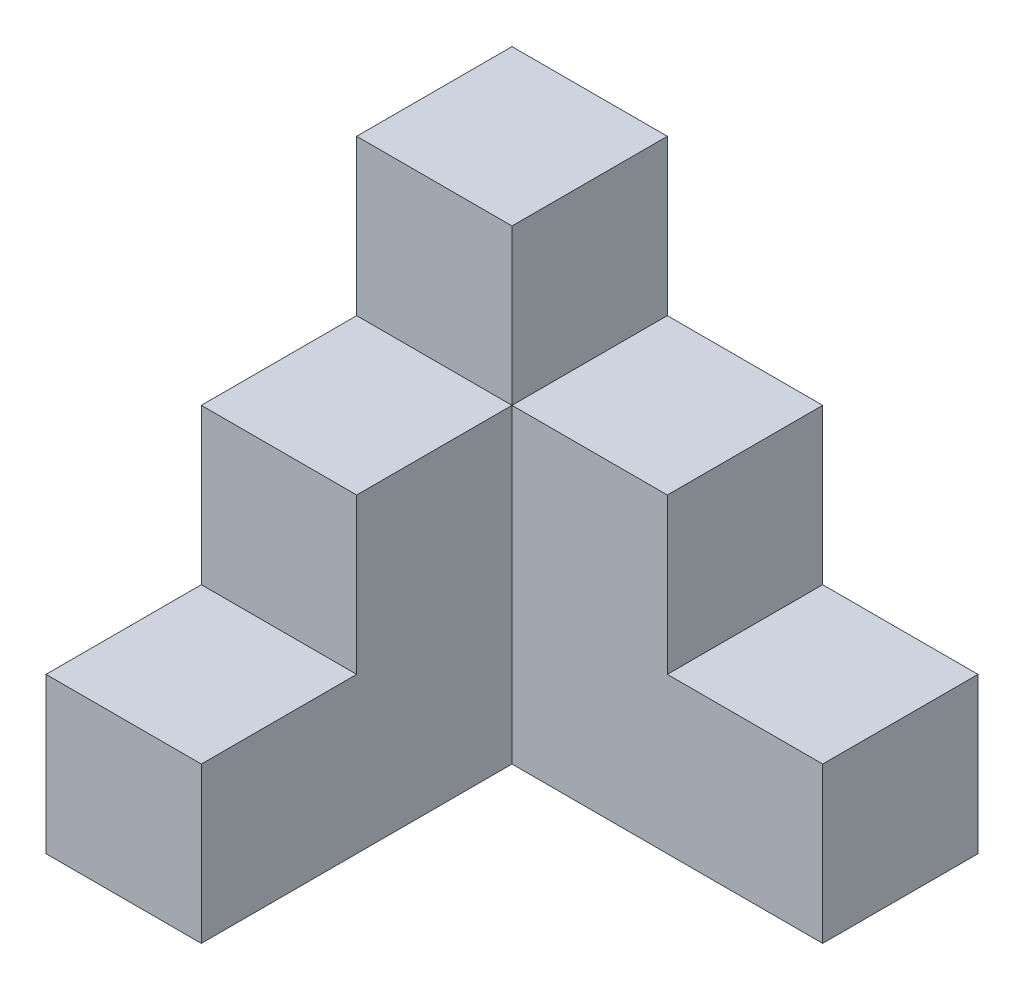
from build123d import *

# Parameters (mm, degrees)
SALIENTE_EXTRUIR1_DEPTH = 10
SALIENTE_EXTRUIR2_DEPTH = 10
CROQUIS4_W              = 10
CROQUIS4_H              = 10
SALIENTE_EXTRUIR3_DEPTH = 10


with BuildPart() as part:
    # Croquis2 → Saliente-Extruir1 (new body)
    with BuildSketch(Plane(origin=(0, 0, 0), x_dir=(1, 0, 0), z_dir=(0, 1, 0))):
        Polygon((-232.247867371, -236.439558246), (-222.247867371, -236.439558246), (-202.247867371, -236.439558246), (-202.247867371, -246.439558246), (-222.247867371, -246.439558246), (-222.247867371, -266.439558246), (-232.247867371, -266.439558246), align=None)
    extrude(amount=SALIENTE_EXTRUIR1_DEPTH)

    # Croquis3 → Saliente-Extruir2 (add)
    with BuildSketch(Plane(origin=(0, 10, 0), x_dir=(1, 0, 0), z_dir=(0, 1, 0))):
        Polygon((-222.247867371, -236.439558246), (-212.247867371, -236.439558246), (-212.247867371, -246.439558246), (-222.247867371, -246.439558246), (-222.247867371, -256.439558246), (-232.247867371, -256.439558246), (-232.247867371, -236.439558246), align=None)
    extrude(amount=SALIENTE_EXTRUIR2_DEPTH)

    # Croquis4 → Saliente-Extruir3 (add)
    with BuildSketch(Plane(origin=(0, 20, 0), x_dir=(1, 0, 0), z_dir=(0, 1, 0))):
        with Locations((-227.247867371, -241.439558246)):
            Rectangle(CROQUIS4_W, CROQUIS4_H)
    extrude(amount=SALIENTE_EXTRUIR3_DEPTH)


solid = part.part
